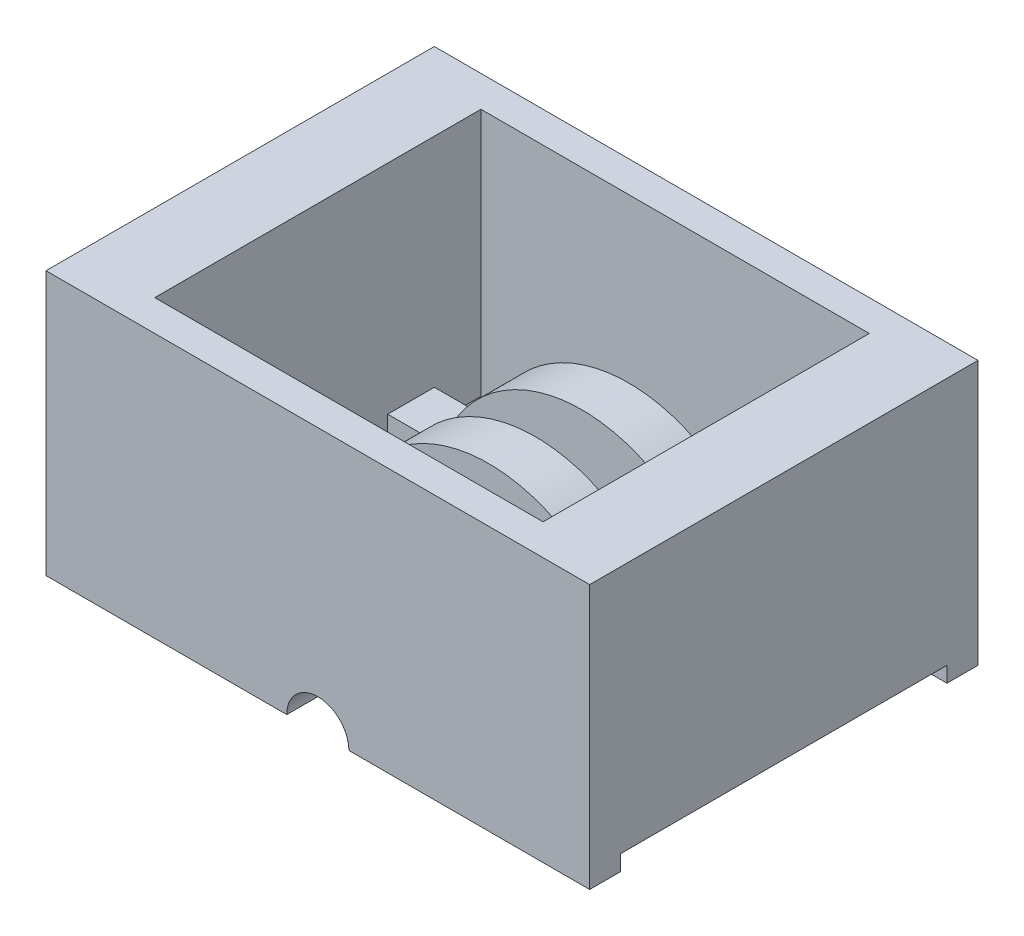
from build123d import *

# Parameters (mm, degrees)
BOSS_EXTRUDE1_DEPTH = 125
SKETCH4_W           = 250
SKETCH4_H           = 210
CUT_EXTRUDE2_DEPTH  = 250
BOSS_EXTRUDE2_DEPTH = 15
LPATTERN1_COUNT     = 2
LPATTERN1_PITCH     = 60
LPATTERN1_COL_COUNT = 2
LPATTERN1_COL_PITCH = 60
SKETCH5_W           = 210
SKETCH5_H           = 10
CUT_EXTRUDE3_DEPTH  = 65
SKETCH6_W           = 210
SKETCH6_H           = 10
CUT_EXTRUDE4_DEPTH  = 65


with BuildPart() as part:
    # Sketch1 → Boss-Extrude1 (new, symmetric)
    with BuildSketch(Plane.XY):
        with BuildLine():
            Line((20, 0), (125, 0))
            Line((125, 0), (175, 0))
            Line((175, 0), (175, 170))
            Line((175, 170), (-175, 170))
            Line((-175, 170), (-175, 0))
            Line((-175, 0), (-125, 0))
            Line((-125, 0), (-20, 0))
            ThreePointArc((-20, 0), (0, 20), (20, 0))
        make_face()
    extrude(amount=BOSS_EXTRUDE1_DEPTH, both=True)

    # Sketch4 → Cut-Extrude2 (cut)
    with BuildSketch(Plane(origin=(0, 170, 0), x_dir=(1, 0, 0), z_dir=(0, 1, 0))):
        Rectangle(SKETCH4_W, SKETCH4_H)
    extrude(amount=-CUT_EXTRUDE2_DEPTH, mode=Mode.SUBTRACT)

    # Sketch3 → Boss-Extrude2 (add, symmetric)
    with BuildSketch(Plane.XY):
        with BuildLine():
            Line((125, 0), (125, 30))
            Line((125, 30), (90.138781887, 30))
            ThreePointArc((90.138781887, 30), (0, 95), (-90.138781887, 30))
            Line((-90.138781887, 30), (-125, 30))
            Line((-125, 30), (-125, 0))
            Line((-125, 0), (-20, 0))
            ThreePointArc((-20, 0), (0, 20), (20, 0))
            Line((20, 0), (125, 0))
        make_face()
    boss_extrude2 = extrude(amount=BOSS_EXTRUDE2_DEPTH, both=True)

    # LPattern1: Boss-Extrude2 ×2
    with Locations(*[(0, 0, i * LPATTERN1_PITCH) for i in range(1, LPATTERN1_COUNT)]):
        add(boss_extrude2)

    # LPattern1 col: Boss-Extrude2 ×2
    with Locations(*[(0, 0, -i * LPATTERN1_COL_PITCH) for i in range(1, LPATTERN1_COL_COUNT)]):
        add(boss_extrude2)

    # Sketch5 → Cut-Extrude3 (cut)
    with BuildSketch(Plane(origin=(175, 0, 0), x_dir=(0, 0, -1), z_dir=(1, 0, 0))):
        with Locations((0, 5)):
            Rectangle(SKETCH5_W, SKETCH5_H)
    extrude(amount=-CUT_EXTRUDE3_DEPTH, mode=Mode.SUBTRACT)

    # Sketch6 → Cut-Extrude4 (cut)
    with BuildSketch(Plane.ZY.offset(175)):
        with Locations((0, 5)):
            Rectangle(SKETCH6_W, SKETCH6_H)
    extrude(amount=-CUT_EXTRUDE4_DEPTH, mode=Mode.SUBTRACT)


solid = part.part
